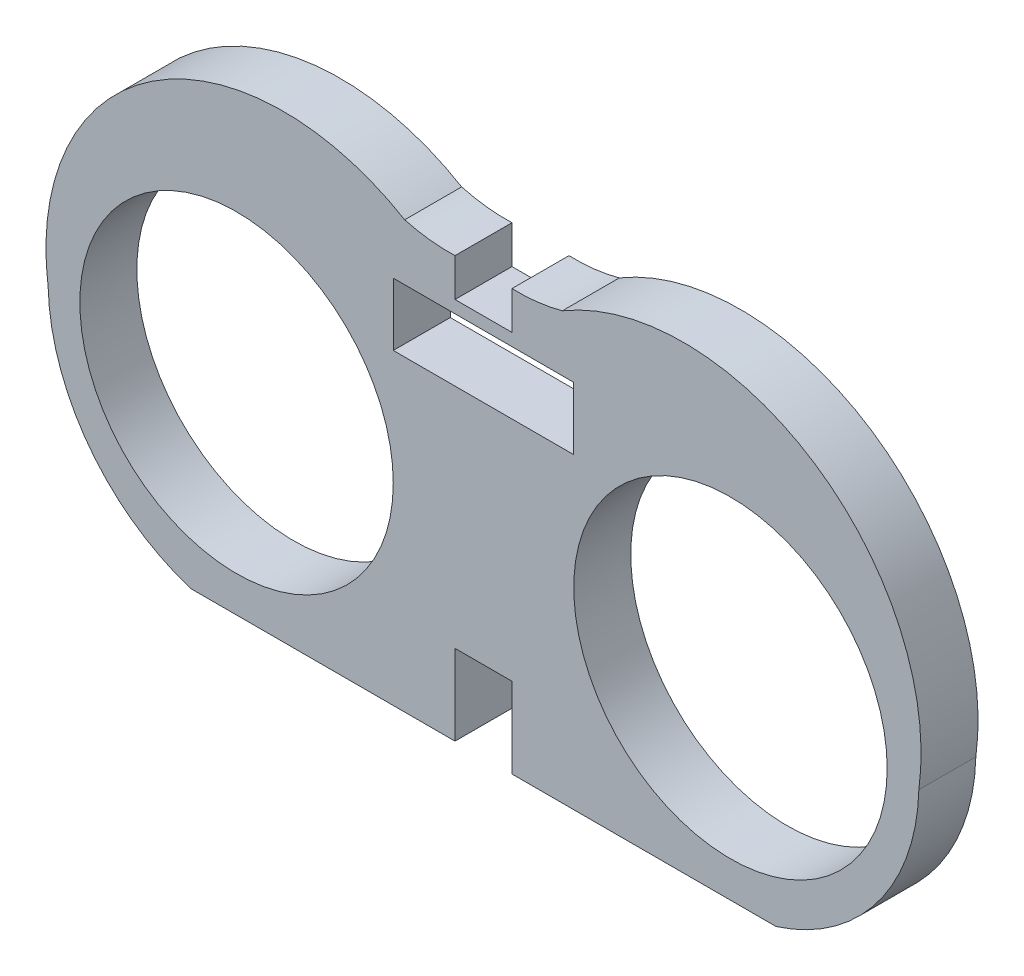
from build123d import *

# Parameters (mm, degrees)
SKETCH1_R           = 8.25
SKETCH1_W           = 9.5
SKETCH1_H           = 3.296
BOSS_EXTRUDE2_DEPTH = 3


with BuildPart() as part:
    # Sketch1 → Boss-Extrude2 (new body)
    with BuildSketch(Plane.XY):
        with BuildLine():
            Line((1.5, 12), (1.5, 10))
            Line((1.5, 10), (-1.5, 10))
            Line((-1.5, 10), (-1.5, 12))
            ThreePointArc((-1.5, 12), (-2.836268406, 12.053611624), (-4.149, 12.309))
            ThreePointArc((-4.149, 12.309), (-17.444023797, 11.979726259), (-22.91780124, -0.140663152))
            ThreePointArc((-22.91780124, -0.140663152), (-20.757463276, -6.337601174), (-15.405, -10.135))
            Line((-15.405, -10.135), (-1.5, -10.135))
            Line((-1.5, -10.135), (-1.5, -5.904))
            Line((-1.5, -5.904), (1.5, -5.904))
            Line((1.5, -5.904), (1.5, -10.135))
            Line((1.5, -10.135), (15.405, -10.135))
            ThreePointArc((15.405, -10.135), (20.757463276, -6.337601174), (22.91780124, -0.140663152))
            ThreePointArc((22.91780124, -0.140663152), (17.444023797, 11.979726259), (4.149, 12.309))
            ThreePointArc((4.149, 12.309), (2.836268406, 12.053611624), (1.5, 12))
        make_face()
        with Locations((-13, 0)):
            Circle(SKETCH1_R, mode=Mode.SUBTRACT)
        with Locations((13, 0)):
            Circle(SKETCH1_R, mode=Mode.SUBTRACT)
        with Locations((0, 7.7)):
            Rectangle(SKETCH1_W, SKETCH1_H, mode=Mode.SUBTRACT)
    extrude(amount=-BOSS_EXTRUDE2_DEPTH)


solid = part.part
